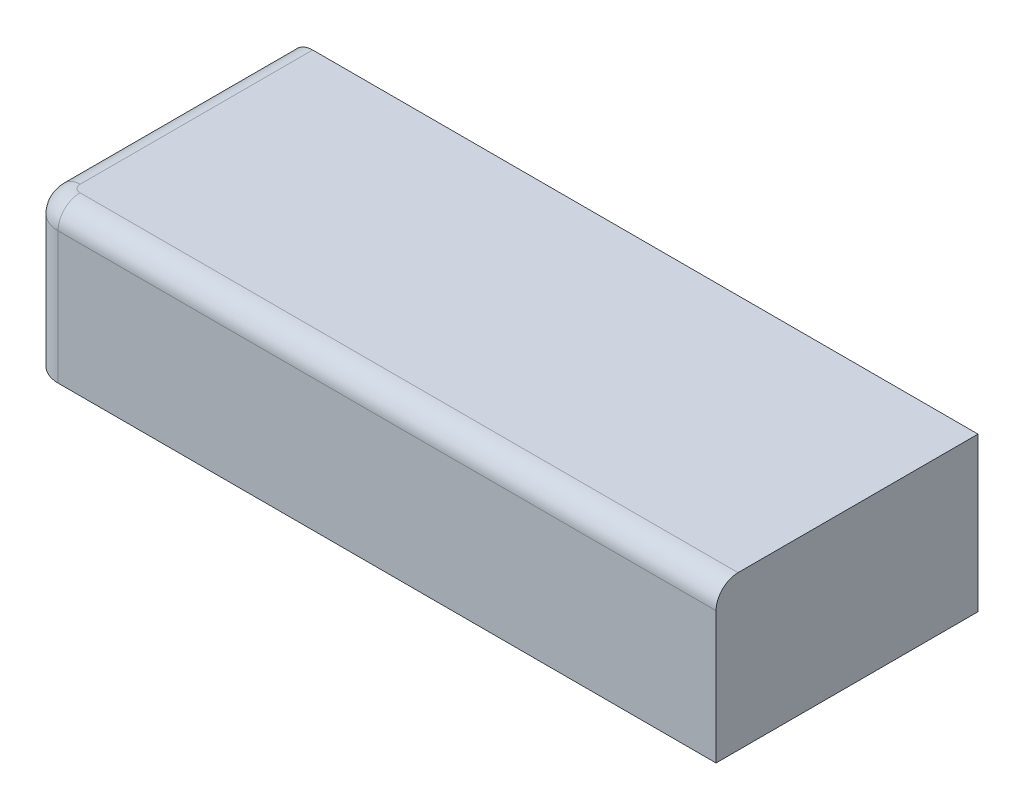
from build123d import *

# Parameters (mm, degrees)
BOSS_EXTRUDE1_DEPTH = 21
FILLET1_R           = 3


with BuildPart() as part:
    # Sketch1 → Boss-Extrude1 (new body)
    with BuildSketch(Plane(origin=(0, 0, 0), x_dir=(1, 0, 0), z_dir=(0, 1, 0))):
        with BuildLine():
            Line((-46.9, 17.875), (46.9, 17.875))
            Line((46.9, 17.875), (46.9, -17.875))
            Line((46.9, -17.875), (-42.9, -17.875))
            ThreePointArc((-42.9, -17.875), (-45.728427125, -16.703427125), (-46.9, -13.875))
            Line((-46.9, -13.875), (-46.9, 17.875))
        make_face()
    extrude(amount=BOSS_EXTRUDE1_DEPTH)

    # Fillet1
    fillet1_edges = [part.edges().sort_by_distance(p)[0] for p in [
        (-46.9, 21, -2),
        (-45.728427125, 21, 16.703427125),
        (2, 21, 17.875),
    ]]
    fillet(fillet1_edges, radius=FILLET1_R)


solid = part.part
